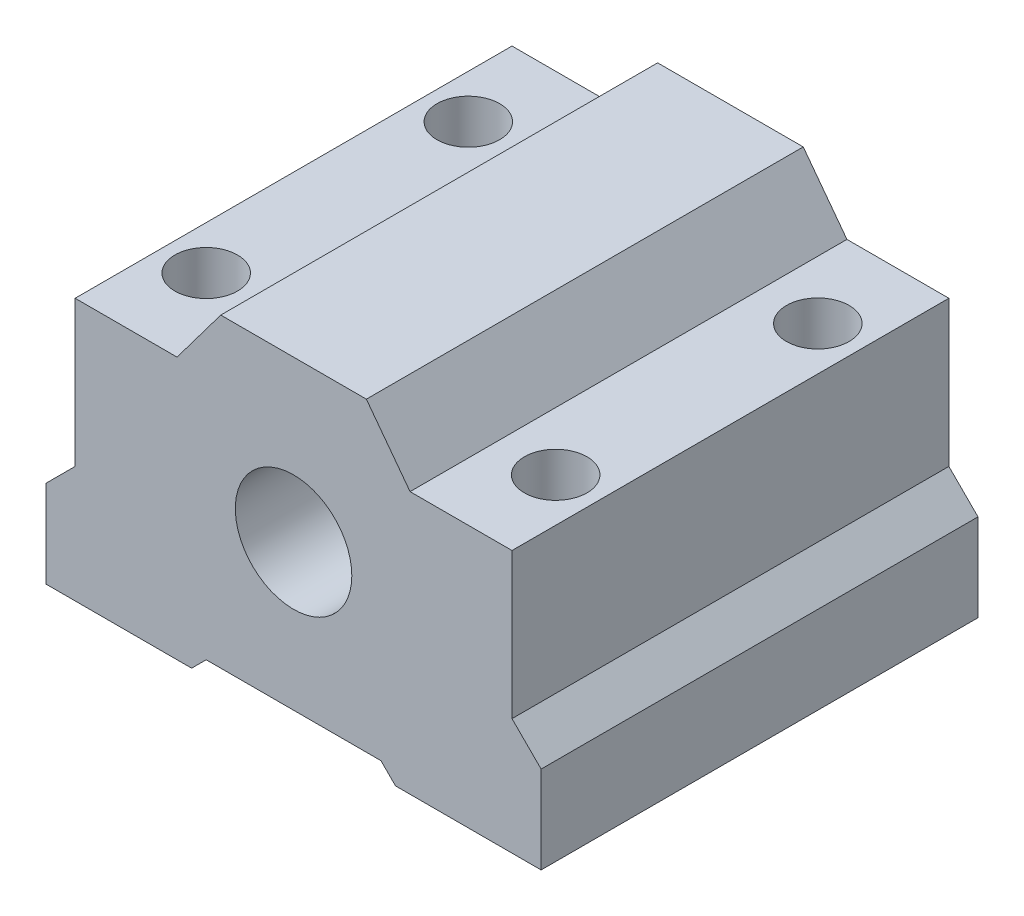
from build123d import *

# Parameters (mm, degrees)
SKETCH_1_R                   = 4
EXTRUDE_1_DEPTH              = 30
HOLE_WIZARD_M5_1_D           = 4.2
HOLE_WIZARD_M5_1_DEPTH       = 18
HOLE_WIZARD_M5_1_CSINK_D     = 5.05
HOLE_WIZARD_M5_1_CSINK_ANGLE = 90
HOLE_WIZARD_M5_1_TIP         = 1.2618073
SKETCH_4_R                   = 2.15
CUT_EXTRUDE_1_DEPTH          = 30


with BuildPart() as part:
    # 草图1 → 凸台-拉伸1 (new body)
    with BuildSketch(Plane.XY):
        Polygon((-5, 11), (5, 11), (8, 7), (15, 7), (15, -3), (17, -5), (17, -11), (7, -11), (6, -10), (-6, -10), (-7, -11), (-17, -11), (-17, -5), (-15, -3), (-15, 7), (-8, 7), align=None)
        Circle(SKETCH_1_R, mode=Mode.SUBTRACT)
    extrude(amount=EXTRUDE_1_DEPTH)

    # M5 螺纹孔1
    with Locations(Plane(origin=(0, -11, 0), x_dir=(-1, 0, 0), z_dir=(0, -1, 0))):
        with Locations((12, -24), (12, -6), (-12, -24), (-12, -6)):
            CounterSinkHole(HOLE_WIZARD_M5_1_D / 2, HOLE_WIZARD_M5_1_CSINK_D / 2, depth=HOLE_WIZARD_M5_1_DEPTH, counter_sink_angle=HOLE_WIZARD_M5_1_CSINK_ANGLE)
            with Locations((0, 0, -(HOLE_WIZARD_M5_1_DEPTH + HOLE_WIZARD_M5_1_TIP / 2))):  # 118° drill point
                Cone(0, HOLE_WIZARD_M5_1_D / 2, HOLE_WIZARD_M5_1_TIP, mode=Mode.SUBTRACT)

    # 草图4 → 切除-拉伸1 (cut)
    with BuildSketch(Plane.XZ.offset(11)):
        with Locations((-12, 24)):
            Circle(SKETCH_4_R)
        with Locations(Location((12, 24, 0), (0, 0, 270))):
            Circle(SKETCH_4_R)
        with Locations(Location((12, 6, 0), (0, 0, 270))):
            Circle(SKETCH_4_R)
        with Locations((-12, 6)):
            Circle(SKETCH_4_R)
    extrude(amount=-CUT_EXTRUDE_1_DEPTH, mode=Mode.SUBTRACT)


solid = part.part
